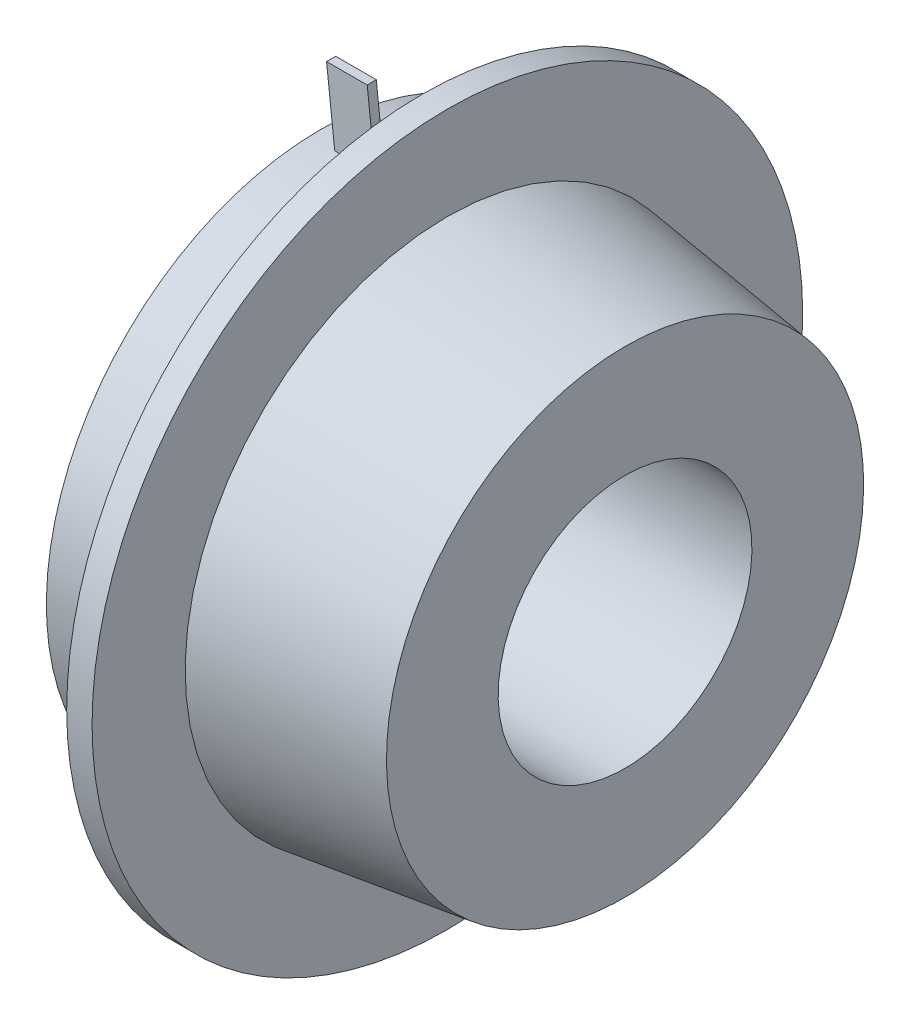
from build123d import *

# Parameters (mm, degrees)
REVOLVE1_ANGLE      = 359.999999589
BOSS_EXTRUDE1_DEPTH = 18
SKETCH3_W           = 50
SKETCH3_H           = 200
REVOLVE2_ANGLE      = 359.999999589


with BuildPart() as part:
    # Sketch1 → Revolve1 (revolve)
    with BuildSketch(Plane.XY):
        Polygon((1250, 250), (1250, 540), (1400, 530), (1550, 510), (1700, 490), (1850, 470), (1850, 250), align=None)
    revolve(axis=Axis((0, 0, 0), (1, 0, 0)), revolution_arc=REVOLVE1_ANGLE)


with BuildPart() as body_2:
    # Sketch2 → Boss-Extrude1 (new body)
    with BuildSketch(Plane.XY):
        Polygon((1300, 500), (1280, 680), (1360, 680), (1380, 500), align=None)
    extrude(amount=BOSS_EXTRUDE1_DEPTH)


with BuildPart() as body_3:
    # Sketch3 → Revolve2 (revolve)
    with BuildSketch(Plane.XY):
        with Locations((1475, 600)):
            Rectangle(SKETCH3_W, SKETCH3_H)
    revolve(axis=Axis((0, 0, 0), (1, 0, 0)), revolution_arc=REVOLVE2_ANGLE)


solid = Compound([part.part, body_2.part, body_3.part])
